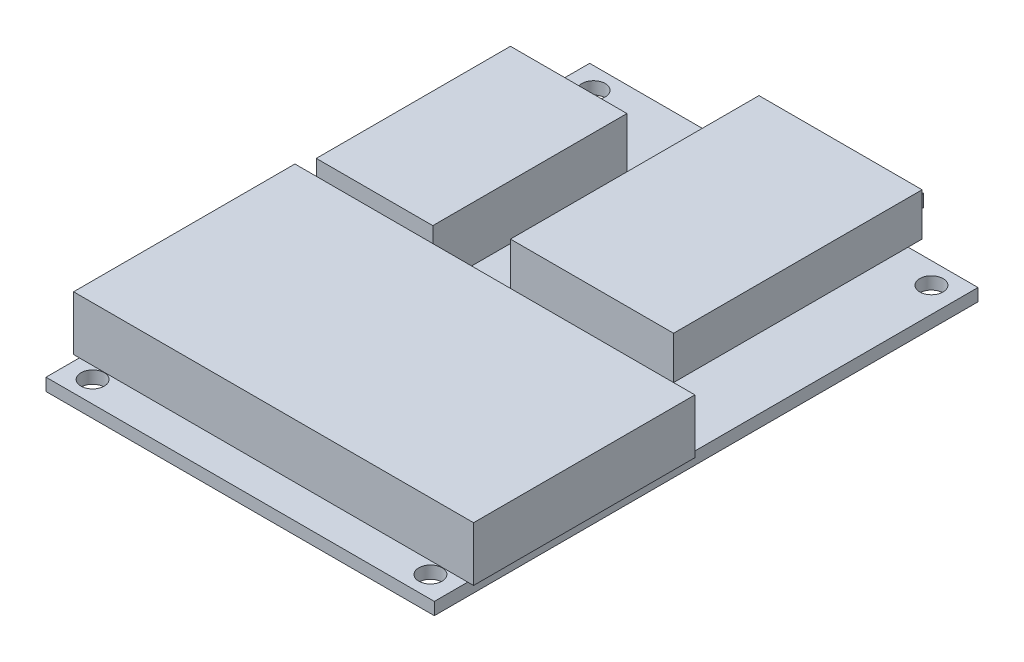
from build123d import *

# Parameters (mm, degrees)
SKETCH_1_W      = 50
SKETCH_1_H      = 70
SKETCH_1_R      = 1.5
EXTRUDE_1_DEPTH = 1.6
SKETCH_3_W      = 51.5
SKETCH_3_H      = 28.5
EXTRUDE_2_DEPTH = 7
SKETCH_4_W      = 15
SKETCH_4_H      = 25
EXTRUDE_3_DEPTH = 7
SKETCH_5_W      = 21
SKETCH_5_H      = 32
EXTRUDE_4_DEPTH = 5.5
SKETCH_6_W      = 11
SKETCH_6_H      = 1.6
EXTRUDE_5_DEPTH = 7


with BuildPart() as part:
    # 草图1 → 凸台-拉伸1 (new body)
    with BuildSketch(Plane(origin=(0, 0, 0), x_dir=(1, 0, 0), z_dir=(0, 1, 0))):
        with Locations((25, 35)):
            Rectangle(SKETCH_1_W, SKETCH_1_H)
        with Locations(Location((3.25, 2.75, 0), (0, 0, 270))):
            Circle(SKETCH_1_R, mode=Mode.SUBTRACT)
        with Locations(Location((46.75, 2.75, 0), (0, 0, 90))):
            Circle(SKETCH_1_R, mode=Mode.SUBTRACT)
        with Locations(Location((46.75, 67.25, 0), (0, 0, 270))):
            Circle(SKETCH_1_R, mode=Mode.SUBTRACT)
        with Locations(Location((3.25, 67.25, 0), (0, 0, 90))):
            Circle(SKETCH_1_R, mode=Mode.SUBTRACT)
    extrude(amount=EXTRUDE_1_DEPTH)

    # 草图3 → 凸台-拉伸2 (add)
    with BuildSketch(Plane(origin=(0, 1.6, 0), x_dir=(1, 0, 0), z_dir=(0, 1, 0))):
        with Locations((25, 18.55)):
            Rectangle(SKETCH_3_W, SKETCH_3_H)
    extrude(amount=EXTRUDE_2_DEPTH)

    # 草图4 → 凸台-拉伸3 (add)
    with BuildSketch(Plane(origin=(0, 1.6, 0), x_dir=(1, 0, 0), z_dir=(0, 1, 0))):
        with Locations((7.5, 47.3)):
            Rectangle(SKETCH_4_W, SKETCH_4_H)
    extrude(amount=EXTRUDE_3_DEPTH)

    # 草图5 → 凸台-拉伸4 (add)
    with BuildSketch(Plane(origin=(0, 1.6, 0), x_dir=(1, 0, 0), z_dir=(0, 1, 0))):
        with Locations((30.5, 55.8)):
            Rectangle(SKETCH_5_W, SKETCH_5_H)
    extrude(amount=EXTRUDE_4_DEPTH)

    # 草图6 → 凸台-拉伸5 (add)
    with BuildSketch(Plane(origin=(0, 0, -70), x_dir=(-1, 0, 0), z_dir=(0, 0, -1))):
        with Locations((-30.5, 0.8)):
            Rectangle(SKETCH_6_W, SKETCH_6_H)
    extrude(amount=EXTRUDE_5_DEPTH)


solid = part.part
